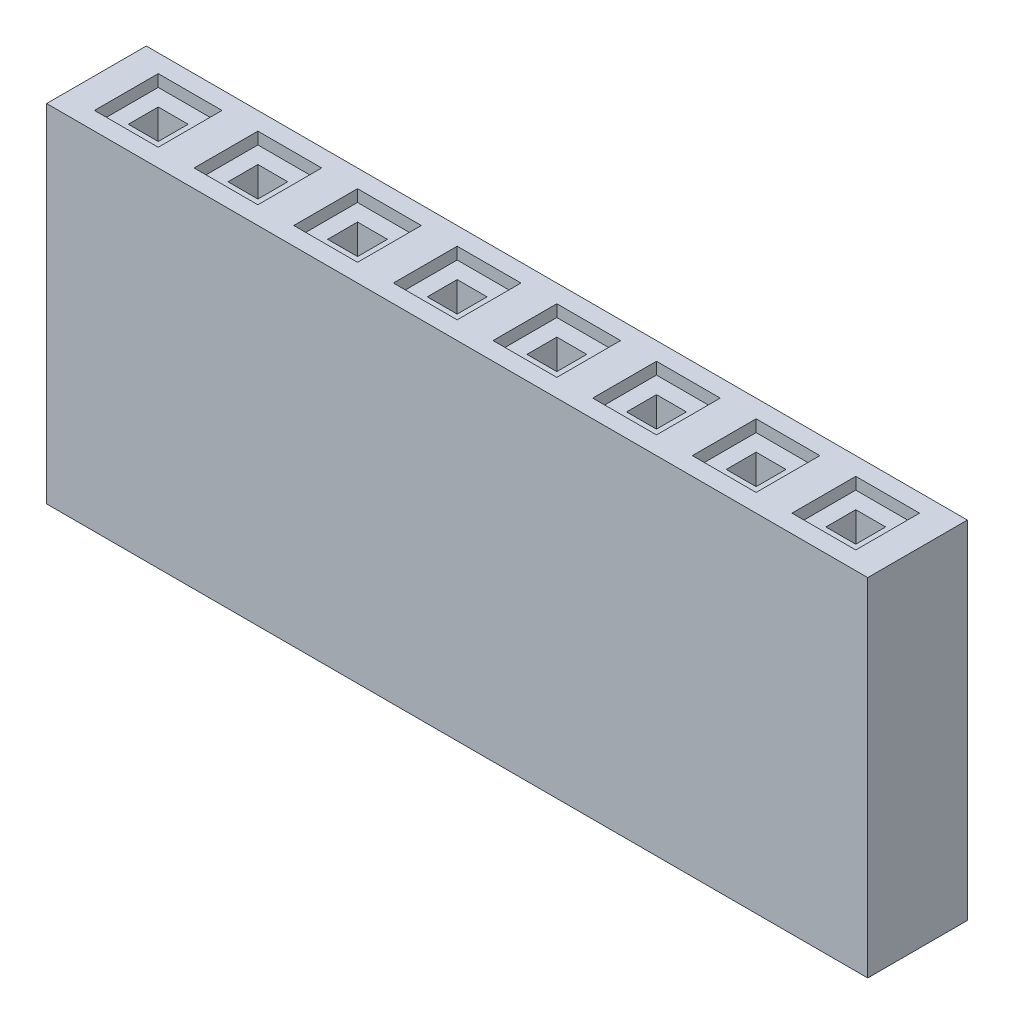
from build123d import *

# Parameters (mm, degrees)
CROQUIS1_W              = 20.6
CROQUIS1_H              = 2.5
SALIENTE_EXTRUIR1_DEPTH = 8.7
CROQUIS3_W              = 1.6
CROQUIS3_H              = 1.6
CORTAR_EXTRUIR1_DEPTH   = 8.5
CROQUIS5_W              = 1.6
CROQUIS5_H              = 1.6
CROQUIS5_W_2            = 0.75
CROQUIS5_H_2            = 0.75
SALIENTE_EXTRUIR2_DEPTH = 8.2


with BuildPart() as part:
    # Croquis1 → Saliente-Extruir1 (new body)
    with BuildSketch(Plane(origin=(0, 0, 0), x_dir=(1, 0, 0), z_dir=(0, 1, 0))):
        Rectangle(CROQUIS1_W, CROQUIS1_H)
    extrude(amount=SALIENTE_EXTRUIR1_DEPTH)

    # Croquis3 → Cortar-Extruir1 (cut)
    with BuildSketch(Plane(origin=(0, 8.7, 0), x_dir=(1, 0, 0), z_dir=(0, 1, 0))):
        with Locations((-8.75, 0)):
            Rectangle(CROQUIS3_W, CROQUIS3_H)
        with Locations((-6.25, 0)):
            Rectangle(CROQUIS3_W, CROQUIS3_H)
        with Locations((-3.75, 0)):
            Rectangle(CROQUIS3_W, CROQUIS3_H)
        with Locations((-1.25, 0)):
            Rectangle(CROQUIS3_W, CROQUIS3_H)
        with Locations((1.25, 0)):
            Rectangle(CROQUIS3_W, CROQUIS3_H)
        with Locations((3.75, 0)):
            Rectangle(CROQUIS3_W, CROQUIS3_H)
        with Locations((6.25, 0)):
            Rectangle(CROQUIS3_W, CROQUIS3_H)
        with Locations((8.75, 0)):
            Rectangle(CROQUIS3_W, CROQUIS3_H)
    extrude(amount=-CORTAR_EXTRUIR1_DEPTH, mode=Mode.SUBTRACT)

    # Croquis5 → Saliente-Extruir2 (add)
    # profile 1 of 8: a face of its own
    with BuildSketch(Plane(origin=(0, 0.2, 0), x_dir=(1, 0, 0), z_dir=(0, 1, 0))):
        with Locations((-8.75, 0)):
            Rectangle(CROQUIS5_W, CROQUIS5_H)
        with Locations((-8.75, 0)):
            Rectangle(CROQUIS5_W_2, CROQUIS5_H_2, mode=Mode.SUBTRACT)
    # profile 2 of 8: a face of its own
    with BuildSketch(Plane(origin=(0, 0.2, 0), x_dir=(1, 0, 0), z_dir=(0, 1, 0))):
        with Locations((-6.25, 0)):
            Rectangle(CROQUIS5_W, CROQUIS5_H)
        with Locations((-6.25, 0)):
            Rectangle(CROQUIS5_W_2, CROQUIS5_H_2, mode=Mode.SUBTRACT)
    # profile 3 of 8: a face of its own
    with BuildSketch(Plane(origin=(0, 0.2, 0), x_dir=(1, 0, 0), z_dir=(0, 1, 0))):
        with Locations((-3.75, 0)):
            Rectangle(CROQUIS5_W, CROQUIS5_H)
        with Locations((-3.75, 0)):
            Rectangle(CROQUIS5_W_2, CROQUIS5_H_2, mode=Mode.SUBTRACT)
    # profile 4 of 8: a face of its own
    with BuildSketch(Plane(origin=(0, 0.2, 0), x_dir=(1, 0, 0), z_dir=(0, 1, 0))):
        with Locations((-1.25, 0)):
            Rectangle(CROQUIS5_W, CROQUIS5_H)
        with Locations((-1.25, 0)):
            Rectangle(CROQUIS5_W_2, CROQUIS5_H_2, mode=Mode.SUBTRACT)
    # profile 5 of 8: a face of its own
    with BuildSketch(Plane(origin=(0, 0.2, 0), x_dir=(1, 0, 0), z_dir=(0, 1, 0))):
        with Locations((1.25, 0)):
            Rectangle(CROQUIS5_W, CROQUIS5_H)
        with Locations((1.25, 0)):
            Rectangle(CROQUIS5_W_2, CROQUIS5_H_2, mode=Mode.SUBTRACT)
    # profile 6 of 8: a face of its own
    with BuildSketch(Plane(origin=(0, 0.2, 0), x_dir=(1, 0, 0), z_dir=(0, 1, 0))):
        with Locations((3.75, 0)):
            Rectangle(CROQUIS5_W, CROQUIS5_H)
        with Locations((3.75, 0)):
            Rectangle(CROQUIS5_W_2, CROQUIS5_H_2, mode=Mode.SUBTRACT)
    # profile 7 of 8: a face of its own
    with BuildSketch(Plane(origin=(0, 0.2, 0), x_dir=(1, 0, 0), z_dir=(0, 1, 0))):
        with Locations((6.25, 0)):
            Rectangle(CROQUIS5_W, CROQUIS5_H)
        with Locations((6.25, 0)):
            Rectangle(CROQUIS5_W_2, CROQUIS5_H_2, mode=Mode.SUBTRACT)
    # profile 8 of 8: a face of its own
    with BuildSketch(Plane(origin=(0, 0.2, 0), x_dir=(1, 0, 0), z_dir=(0, 1, 0))):
        with Locations((8.75, 0)):
            Rectangle(CROQUIS5_W, CROQUIS5_H)
        with Locations((8.75, 0)):
            Rectangle(CROQUIS5_W_2, CROQUIS5_H_2, mode=Mode.SUBTRACT)
    extrude(amount=SALIENTE_EXTRUIR2_DEPTH)


solid = part.part
